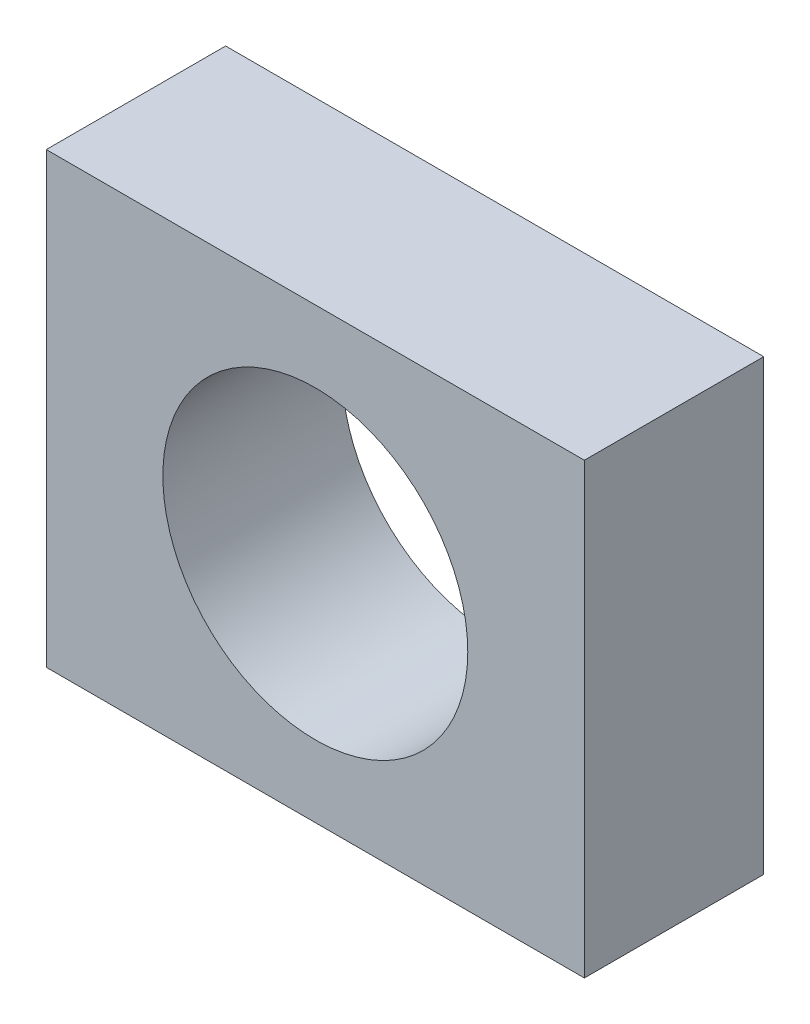
from build123d import *

# Parameters (mm, degrees)
SKETCH1_W           = 3
SKETCH1_H           = 2.5
SKETCH1_R           = 0.85
BOSS_EXTRUDE1_DEPTH = 1


with BuildPart() as part:
    # Sketch1 → Boss-Extrude1 (new body)
    with BuildSketch(Plane.XY):
        Rectangle(SKETCH1_W, SKETCH1_H)
        Circle(SKETCH1_R, mode=Mode.SUBTRACT)
    extrude(amount=BOSS_EXTRUDE1_DEPTH)


solid = part.part
